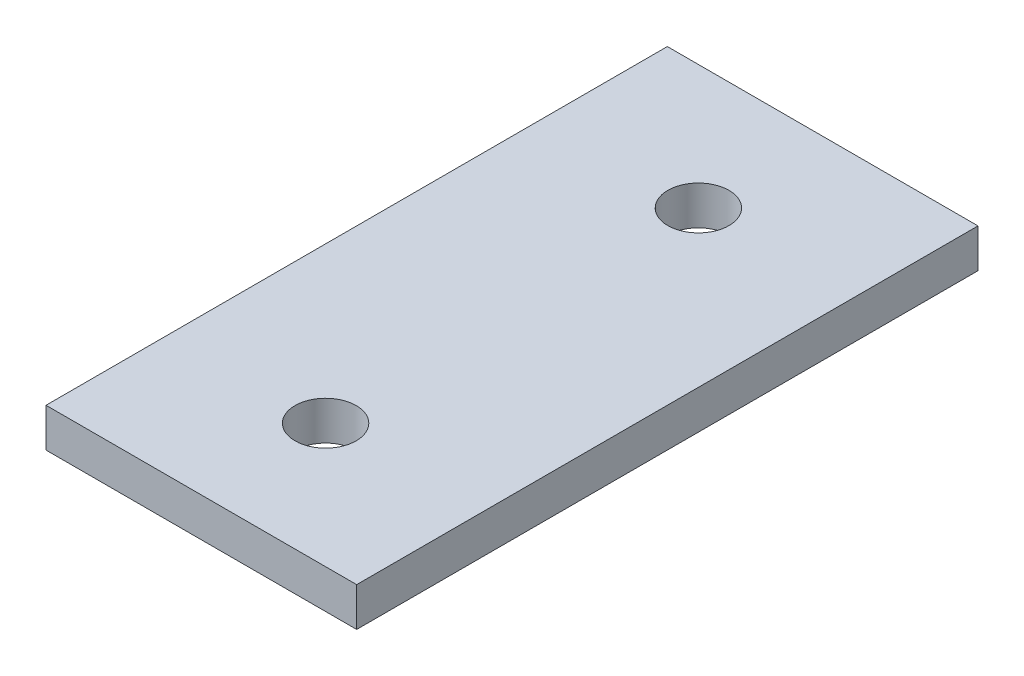
from build123d import *

# Parameters (mm, degrees)
SKETCH1_W             = 12.7
SKETCH1_H             = 25.4
BOSS_EXTRUDE1_DEPTH   = 1.5875
M3X0_5_TAPPED_HOLE1_D = 2.5


with BuildPart() as part:
    # Sketch1 → Boss-Extrude1 (new body)
    with BuildSketch(Plane(origin=(0, 0, 0), x_dir=(1, 0, 0), z_dir=(0, 1, 0))):
        with Locations((6.35, 12.7)):
            Rectangle(SKETCH1_W, SKETCH1_H)
    extrude(amount=BOSS_EXTRUDE1_DEPTH)

    # M3x0.5 Tapped Hole1 (through all)
    with Locations(Plane(origin=(0, 1.5875, 0), x_dir=(1, 0, 0), z_dir=(0, 1, 0))):
        with Locations((6.35, 20.32), (6.35, 5.08)):
            Hole(M3X0_5_TAPPED_HOLE1_D / 2)


solid = part.part
